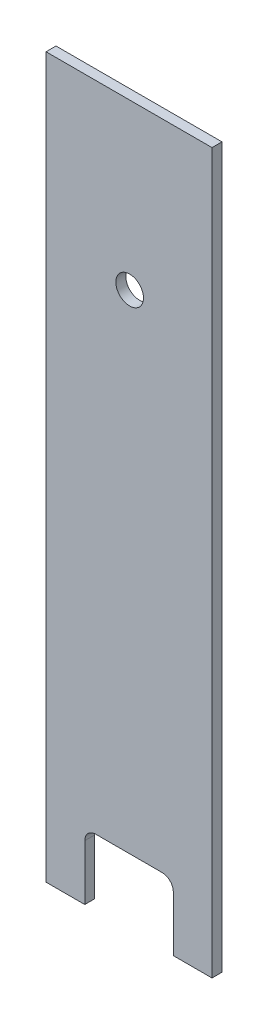
from build123d import *

# Parameters (mm, degrees)
ESBO_O1_W                = 30
ESBO_O1_H                = 130
RESSALTO_EXTRUS_O1_DEPTH = 1.8
ESBO_O2_R                = 2.5
CORTE_EXTRUS_O1_DEPTH    = 10
CORTE_EXTRUS_O2_DEPTH    = 10.2


with BuildPart() as part:
    # Esboço1 → Ressalto-extrusão1 (new body)
    with BuildSketch(Plane.XY):
        with Locations((-11.632173448, -41.380470016)):
            Rectangle(ESBO_O1_W, ESBO_O1_H)
    extrude(amount=RESSALTO_EXTRUS_O1_DEPTH)

    # Esboço2 → Corte-extrusão1 (cut)
    with BuildSketch(Plane(origin=(0, 0, 0), x_dir=(-1, 0, 0), z_dir=(0, 0, -1))):
        with Locations((11.517661918, -6.126398996)):
            Circle(ESBO_O2_R)
    extrude(amount=-CORTE_EXTRUS_O1_DEPTH, mode=Mode.SUBTRACT)

    # Esboço3 → Corte-extrusão2 (cut)
    with BuildSketch(Plane(origin=(0, 0, 0), x_dir=(-1, 0, 0), z_dir=(0, 0, -1))):
        with BuildLine():
            Line((3.632173448, -106.380470016), (19.632173448, -106.380470016))
            Line((19.632173448, -106.380470016), (19.632173448, -96.380470016))
            ThreePointArc((19.632173448, -96.380470016), (19.04638701, -94.966256454), (17.632173448, -94.380470016))
            Line((17.632173448, -94.380470016), (5.632173448, -94.380470016))
            ThreePointArc((5.632173448, -94.380470016), (4.217959885, -94.966256454), (3.632173448, -96.380470016))
            Line((3.632173448, -96.380470016), (3.632173448, -106.380470016))
        make_face()
    extrude(amount=-CORTE_EXTRUS_O2_DEPTH, mode=Mode.SUBTRACT)


solid = part.part
